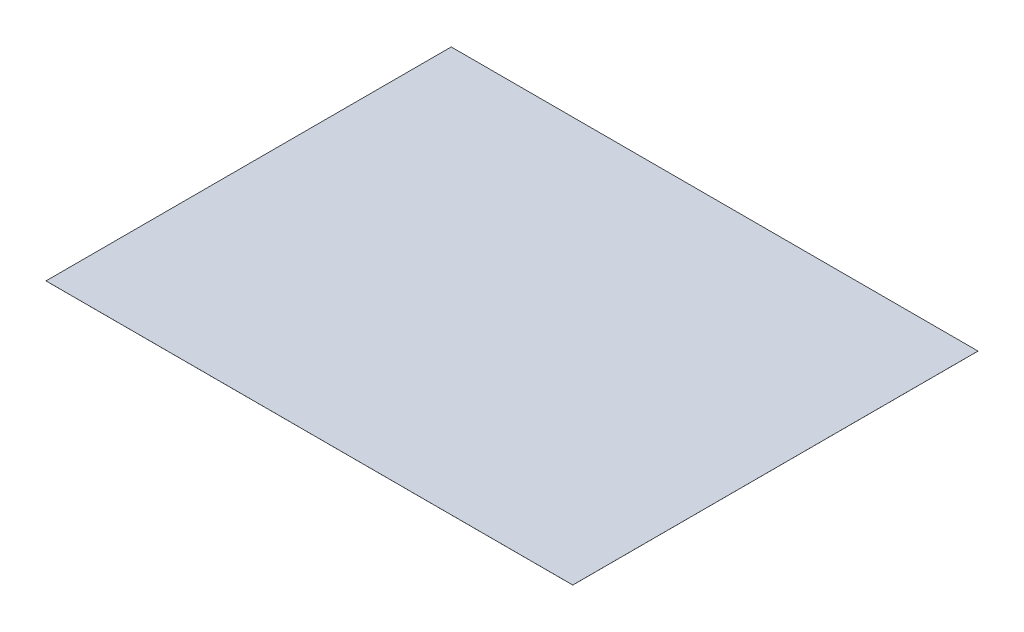
from build123d import *

# Parameters (mm, degrees)
SKETCH_1_W      = 1300
SKETCH_1_H      = 1000
EXTRUDE_1_DEPTH = 0.1


with BuildPart() as part:
    # 草图1 → 凸台-拉伸1 (new body)
    with BuildSketch(Plane(origin=(0, 0, 0), x_dir=(1, 0, 0), z_dir=(0, 1, 0))):
        Rectangle(SKETCH_1_W, SKETCH_1_H)
    extrude(amount=EXTRUDE_1_DEPTH)


solid = part.part
